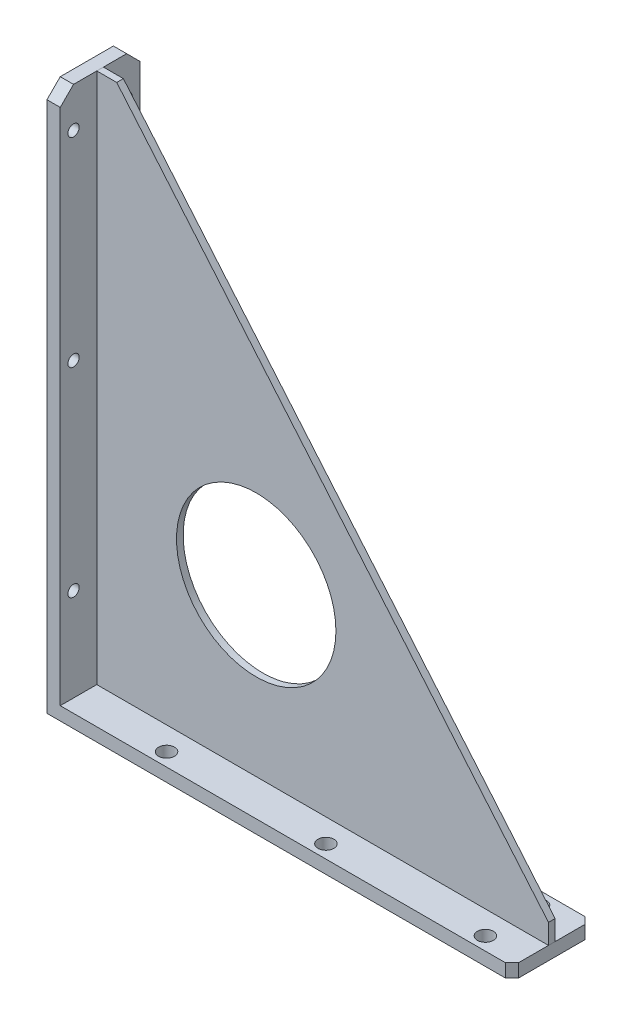
from build123d import *

# Parameters (mm, degrees)
EXTRUDE_1_DEPTH                  = 60
CHAMFER_1_SIZE                   = 10
CHAMFER_2_SIZE                   = 5
GUSSET_1_THICKNESS               = 5
HOLE_WIZARD_M10_2_AT_2_COUNT     = 2
HOLE_WIZARD_M10_2_AT_2_PITCH     = 150
HOLE_WIZARD_M10_2_AT_3_COUNT     = 2
HOLE_WIZARD_M10_2_AT_3_PITCH     = 40
HOLE_WIZARD_M10_2_AT_4_COUNT     = 2
HOLE_WIZARD_M10_2_AT_4_PITCH     = 155.241746963
HOLE_WIZARD_M10_2_AT_5_COUNT     = 2
HOLE_WIZARD_M10_2_AT_5_PITCH     = 300
HOLE_WIZARD_M10_2_AT_6_COUNT     = 2
HOLE_WIZARD_M10_2_AT_6_PITCH     = 302.654919008
HOLE_WIZARD_12_0_12_3_AT_2_COUNT = 2
HOLE_WIZARD_12_0_12_3_AT_2_PITCH = 120
HOLE_WIZARD_12_0_12_3_AT_3_COUNT = 2
HOLE_WIZARD_12_0_12_3_AT_3_PITCH = 40
HOLE_WIZARD_12_0_12_3_AT_4_COUNT = 2
HOLE_WIZARD_12_0_12_3_AT_4_PITCH = 126.491106407
HOLE_WIZARD_12_0_12_3_AT_5_COUNT = 2
HOLE_WIZARD_12_0_12_3_AT_5_PITCH = 120
HOLE_WIZARD_12_0_12_3_AT_6_COUNT = 2
HOLE_WIZARD_12_0_12_3_AT_6_PITCH = 126.491106407
SKETCH_11_R                      = 60
CUT_EXTRUDE_1_DEPTH              = 10


with BuildPart() as part:
    # 草图1 → 凸台-拉伸1 (new body)
    with BuildSketch(Plane.XY):
        Polygon((0, 0), (0, 410), (10, 410), (10, 10), (350, 10), (350, 0), align=None)
    extrude(amount=EXTRUDE_1_DEPTH)

    # 倒角1
    chamfer_1_edges = [part.edges().sort_by_distance(p)[0] for p in [
        (5, 410, 60),
        (5, 410, 0),
    ]]
    chamfer(chamfer_1_edges, length=CHAMFER_1_SIZE)

    # 倒角2
    chamfer_2_edges = [part.edges().sort_by_distance(p)[0] for p in [
        (350, 5, 60),
        (350, 5, 0),
    ]]
    chamfer(chamfer_2_edges, length=CHAMFER_2_SIZE)

    # 草图8 → M10 螺纹孔2 (revolve, cut)
    with BuildSketch(Plane(origin=(10, 380, 50), x_dir=(0, 0, -1), z_dir=(0, 1, 0))):
        Polygon((0, 0), (0, 30.053657631), (4.25, 27.5), (4.25, 0), align=None)
    hole_wizard_m10_2 = revolve(axis=Axis((16.35, 380, 50), (-1, 0, 0)), mode=Mode.SUBTRACT)

    # M10 螺纹孔2 at 2: M10 螺纹孔2 ×2
    with Locations(*[(0, -i * HOLE_WIZARD_M10_2_AT_2_PITCH, 0) for i in range(1, HOLE_WIZARD_M10_2_AT_2_COUNT)]):
        add(hole_wizard_m10_2, mode=Mode.SUBTRACT)

    # M10 螺纹孔2 at 3: M10 螺纹孔2 ×2
    with Locations(*[(0, 0, -i * HOLE_WIZARD_M10_2_AT_3_PITCH) for i in range(1, HOLE_WIZARD_M10_2_AT_3_COUNT)]):
        add(hole_wizard_m10_2, mode=Mode.SUBTRACT)

    # M10 螺纹孔2 at 4: M10 螺纹孔2 ×2
    with Locations(*[Vector(0, -0.9662349396012463, -0.25766265056033233) * (i * HOLE_WIZARD_M10_2_AT_4_PITCH) for i in range(1, HOLE_WIZARD_M10_2_AT_4_COUNT)]):
        add(hole_wizard_m10_2, mode=Mode.SUBTRACT)

    # M10 螺纹孔2 at 5: M10 螺纹孔2 ×2
    with Locations(*[(0, -i * HOLE_WIZARD_M10_2_AT_5_PITCH, 0) for i in range(1, HOLE_WIZARD_M10_2_AT_5_COUNT)]):
        add(hole_wizard_m10_2, mode=Mode.SUBTRACT)

    # M10 螺纹孔2 at 6: M10 螺纹孔2 ×2
    with Locations(*[Vector(0, -0.9912279006826347, -0.13216372009101798) * (i * HOLE_WIZARD_M10_2_AT_6_PITCH) for i in range(1, HOLE_WIZARD_M10_2_AT_6_COUNT)]):
        add(hole_wizard_m10_2, mode=Mode.SUBTRACT)

    # 草图10 → Ø12.0 (12) 直径孔3 (revolve, cut)
    with BuildSketch(Plane(origin=(200, 10, 50), x_dir=(0, 0, 1), z_dir=(1, 0, 0))):
        Polygon((0, 0), (0, 31.105163714), (6, 27.5), (6, 0), align=None)
    hole_wizard_12_0_12_3 = revolve(axis=Axis((200, 16.35, 50), (0, -1, 0)), mode=Mode.SUBTRACT)

    # Ø12.0 (12) 直径孔3 at 2: Ø12.0 (12) 直径孔3 ×2
    with Locations(*[(i * HOLE_WIZARD_12_0_12_3_AT_2_PITCH, 0, 0) for i in range(1, HOLE_WIZARD_12_0_12_3_AT_2_COUNT)]):
        add(hole_wizard_12_0_12_3, mode=Mode.SUBTRACT)

    # Ø12.0 (12) 直径孔3 at 3: Ø12.0 (12) 直径孔3 ×2
    with Locations(*[(0, 0, -i * HOLE_WIZARD_12_0_12_3_AT_3_PITCH) for i in range(1, HOLE_WIZARD_12_0_12_3_AT_3_COUNT)]):
        add(hole_wizard_12_0_12_3, mode=Mode.SUBTRACT)

    # Ø12.0 (12) 直径孔3 at 4: Ø12.0 (12) 直径孔3 ×2
    with Locations(*[Vector(0.9486832980505139, 0, -0.316227766016838) * (i * HOLE_WIZARD_12_0_12_3_AT_4_PITCH) for i in range(1, HOLE_WIZARD_12_0_12_3_AT_4_COUNT)]):
        add(hole_wizard_12_0_12_3, mode=Mode.SUBTRACT)

    # Ø12.0 (12) 直径孔3 at 5: Ø12.0 (12) 直径孔3 ×2
    with Locations(*[(-i * HOLE_WIZARD_12_0_12_3_AT_5_PITCH, 0, 0) for i in range(1, HOLE_WIZARD_12_0_12_3_AT_5_COUNT)]):
        add(hole_wizard_12_0_12_3, mode=Mode.SUBTRACT)

    # Ø12.0 (12) 直径孔3 at 6: Ø12.0 (12) 直径孔3 ×2
    with Locations(*[Vector(-0.9486832980505138, 0, -0.316227766016838) * (i * HOLE_WIZARD_12_0_12_3_AT_6_PITCH) for i in range(1, HOLE_WIZARD_12_0_12_3_AT_6_COUNT)]):
        add(hole_wizard_12_0_12_3, mode=Mode.SUBTRACT)


with BuildPart() as body_2:
    # Gusset 1: a gusset: a plate 5.0 thick in the corner of two members, its outline drawn in place
    gusset_1_outline = Wire([Line((10, 10, 27.5), (10, 410, 27.5)), Line((10, 410, 27.5), (25, 410, 27.5)), Line((25, 410, 27.5), (350, 25, 27.5)), Line((350, 25, 27.5), (350, 10, 27.5)), Line((350, 10, 27.5), (10, 10, 27.5))])
    add(extrude(Face(gusset_1_outline), amount=GUSSET_1_THICKNESS, dir=(0, 0, 1)))

    # 草图11 → 切除-拉伸1 (cut)
    with BuildSketch(Plane.XY.offset(32.5)):
        with Locations((130, 135)):
            Circle(SKETCH_11_R)
    extrude(amount=-CUT_EXTRUDE_1_DEPTH, mode=Mode.SUBTRACT)


solid = Compound([part.part, body_2.part])
